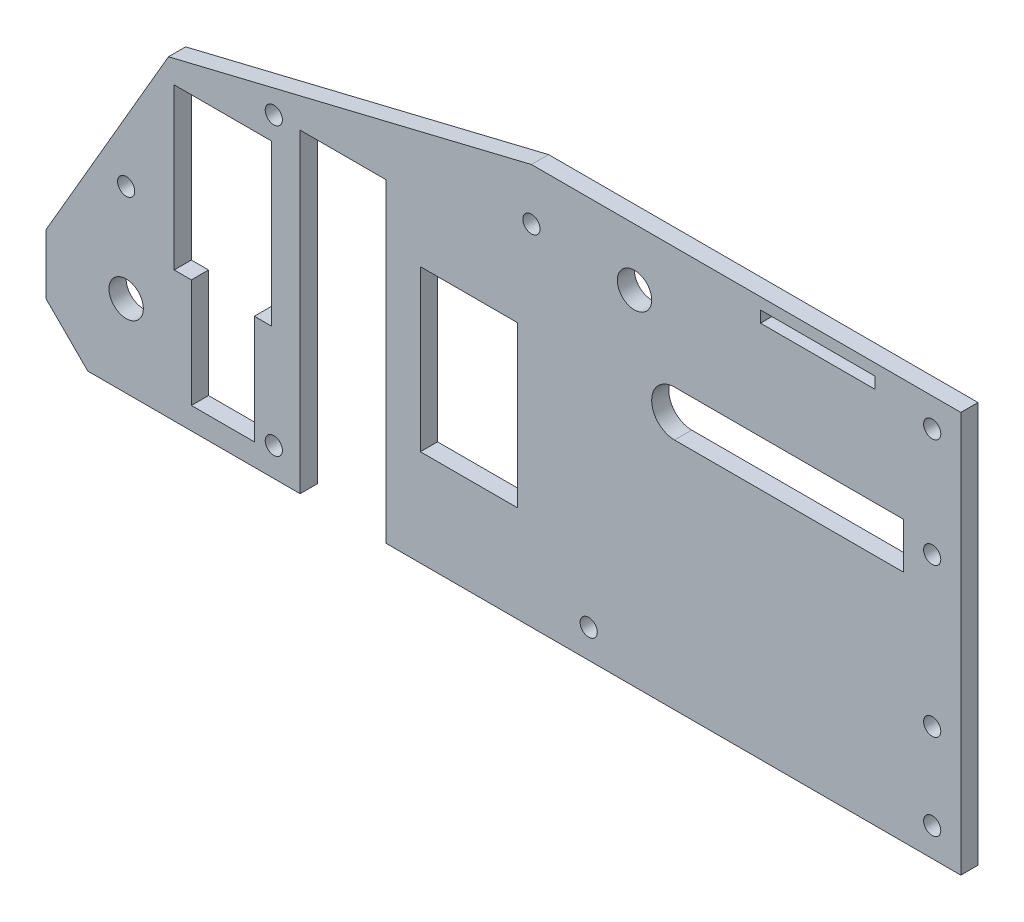
from build123d import *

# Parameters (mm, degrees)
SKETCH1_R           = 1.25
SKETCH1_R_2         = 0.75
SKETCH1_W           = 60
SKETCH1_H           = 20
SKETCH1_W_2         = 5
SKETCH1_H_2         = 1
BOSS_EXTRUDE2_DEPTH = 3
SKETCH3_R           = 1.25
CUT_EXTRUDE2_DEPTH  = 3
BOSS_EXTRUDE4_START = -3
SKETCH15_R          = 0.75
BOSS_EXTRUDE4_DEPTH = 3
SKETCH23_R          = 0.75
CUT_EXTRUDE21_DEPTH = 10
SKETCH24_R          = 0.75
CUT_EXTRUDE22_DEPTH = 10
CUT_EXTRUDE23_DEPTH = 10
SKETCH28_W          = 17
SKETCH28_H          = 28
CUT_EXTRUDE25_DEPTH = 3
SKETCH30_R          = 3
CUT_EXTRUDE26_DEPTH = 3
CUT_EXTRUDE28_DEPTH = 3
SKETCH32_R          = 3
CUT_EXTRUDE29_DEPTH = 3
SKETCH33_W          = 10
SKETCH33_H          = 1
CUT_EXTRUDE30_DEPTH = 3
CUT_EXTRUDE32_DEPTH = 3
SKETCH36_R          = 1.5
CUT_EXTRUDE33_DEPTH = 3
SKETCH37_R          = 1.5
CUT_EXTRUDE34_DEPTH = 3
CUT_EXTRUDE36_DEPTH = 3
BOSS_EXTRUDE5_START = -3
SKETCH40_R          = 1.25
BOSS_EXTRUDE5_DEPTH = 3
BOSS_EXTRUDE6_START = -3
SKETCH41_R          = 1.25
BOSS_EXTRUDE6_DEPTH = 3
SKETCH42_R          = 1.5
CUT_EXTRUDE37_DEPTH = 3
SKETCH43_R          = 1.5
CUT_EXTRUDE38_DEPTH = 3
SKETCH44_R          = 1.5
CUT_EXTRUDE39_DEPTH = 3
SKETCH45_R          = 1.5
CUT_EXTRUDE40_DEPTH = 3
SKETCH46_R          = 1.5
CUT_EXTRUDE41_DEPTH = 3
SKETCH47_W          = 20
SKETCH47_H          = 1
CUT_EXTRUDE42_DEPTH = 3
SKETCH48_W          = 11
SKETCH48_H          = 19
CUT_EXTRUDE44_DEPTH = 10


with BuildPart() as part:
    # Sketch1 → Boss-Extrude2 (new body)
    with BuildSketch(Plane.XY):
        Polygon((58.345821786, 13.119852123), (58.345821786, -56.880147877), (-191.654178214, -56.880147877), (-191.654178214, -26.880147877), (-221.654178214, -6.880147877), (-221.654178214, 33.119852123), (-121.654178214, 33.119852123), (-91.654178214, 13.119852123), align=None)
        with Locations((53.345821786, 7.945541925)):
            Circle(SKETCH1_R, mode=Mode.SUBTRACT)
        with Locations((53.345821786, -52.054458075)):
            Circle(SKETCH1_R, mode=Mode.SUBTRACT)
        with Locations((25.505821786, -18.330147877)):
            Circle(SKETCH1_R_2, mode=Mode.SUBTRACT)
        with Locations((-181.654178214, 13.119852123)):
            Rectangle(SKETCH1_W, SKETCH1_H, mode=Mode.SUBTRACT)
        with Locations((25.845821786, 10.619852123)):
            Rectangle(SKETCH1_W_2, SKETCH1_H_2, mode=Mode.SUBTRACT)
        with Locations((40.845821786, 10.619852123)):
            Rectangle(SKETCH1_W_2, SKETCH1_H_2, mode=Mode.SUBTRACT)
    extrude(amount=BOSS_EXTRUDE2_DEPTH)

    # Sketch3 → Cut-Extrude2 (cut)
    with BuildSketch(Plane.XY.offset(3)):
        with Locations((1.345821786, 3.119852123)):
            Circle(SKETCH3_R)
    extrude(amount=-CUT_EXTRUDE2_DEPTH, mode=Mode.SUBTRACT)

    # Sketch15 → Boss-Extrude4 (add)
    with BuildSketch(Plane.XY.offset(3).offset(BOSS_EXTRUDE4_START)):
        with Locations((25.505821786, -18.330147877)):
            Circle(SKETCH15_R)
    extrude(amount=BOSS_EXTRUDE4_DEPTH)

    # Sketch23 → Cut-Extrude21 (cut)
    with BuildSketch(Plane.XY.offset(3)):
        with Locations((-93.524701832, -7.521447448)):
            Circle(SKETCH23_R)
    extrude(amount=-CUT_EXTRUDE21_DEPTH, mode=Mode.SUBTRACT)

    # Sketch24 → Cut-Extrude22 (cut)
    with BuildSketch(Plane.XY.offset(3)):
        with Locations((-107.363654596, -9.638848305)):
            Circle(SKETCH24_R)
    extrude(amount=-CUT_EXTRUDE22_DEPTH, mode=Mode.SUBTRACT)

    # Sketch26 → Cut-Extrude23 (cut)
    with BuildSketch(Plane.XY.offset(3)):
        Polygon((-103.444178214, -47.580147877), (-103.444178214, -42.580147877), (-80.054178214, -2.280147877), (-16.654178214, 13.119852123), (-91.654178214, 13.119852123), (-121.654178214, 33.119852123), (-221.654178214, 33.119852123), (-221.654178214, -6.880147877), (-191.654178214, -26.880147877), (-191.654178214, -56.880147877), (-94.144178214, -56.880147877), align=None)
    extrude(amount=-CUT_EXTRUDE23_DEPTH, mode=Mode.SUBTRACT)

    # Sketch28 → Cut-Extrude25 (cut)
    with BuildSketch(Plane.XY.offset(3)):
        with Locations((-27.554178214, -26.030147877)):
            Rectangle(SKETCH28_W, SKETCH28_H)
        with Locations((-70.554178214, -20.030147877)):
            Rectangle(SKETCH28_W, SKETCH28_H)
    extrude(amount=-CUT_EXTRUDE25_DEPTH, mode=Mode.SUBTRACT)

    # Sketch30 → Cut-Extrude26 (cut)
    with BuildSketch(Plane.XY.offset(3)):
        with Locations((-87.444178214, -42.580147877)):
            Circle(SKETCH30_R)
    extrude(amount=-CUT_EXTRUDE26_DEPTH, mode=Mode.SUBTRACT)

    # Sketch31 → Cut-Extrude28 (cut)
    with BuildSketch(Plane.XY.offset(3)):
        with BuildLine():
            Line((48.345821786, -11.054458075), (48.345821786, -8.054458075))
            Line((48.345821786, -8.054458075), (8.345821786, -8.054458075))
            ThreePointArc((8.345821786, -8.054458075), (4.345821786, -12.054458075), (8.345821786, -16.054458075))
            Line((8.345821786, -16.054458075), (48.345821786, -16.054458075))
            Line((48.345821786, -16.054458075), (48.345821786, -11.054458075))
        make_face()
    extrude(amount=-CUT_EXTRUDE28_DEPTH, mode=Mode.SUBTRACT)

    # Sketch32 → Cut-Extrude29 (cut)
    with BuildSketch(Plane.XY.offset(3)):
        with Locations((1.345821786, 3.119852123)):
            Circle(SKETCH32_R)
    extrude(amount=-CUT_EXTRUDE29_DEPTH, mode=Mode.SUBTRACT)

    # Sketch33 → Cut-Extrude30 (cut)
    with BuildSketch(Plane.XY.offset(3)):
        with Locations((33.345821786, 10.619852123)):
            Rectangle(SKETCH33_W, SKETCH33_H)
    extrude(amount=-CUT_EXTRUDE30_DEPTH, mode=Mode.SUBTRACT)

    # Sketch35 → Cut-Extrude32 (cut)
    with BuildSketch(Plane.XY.offset(3)):
        Polygon((-101.444178214, -45.080147877), (-101.444178214, -39.134230818), (-103.444178214, -42.580147877), (-103.444178214, -47.580147877), (-101.444178214, -49.580147877), align=None)
    extrude(amount=-CUT_EXTRUDE32_DEPTH, mode=Mode.SUBTRACT)

    # Sketch36 → Cut-Extrude33 (cut)
    with BuildSketch(Plane.XY.offset(3)):
        with Locations((-61.654178214, -1.880147877)):
            Circle(SKETCH36_R)
    extrude(amount=-CUT_EXTRUDE33_DEPTH, mode=Mode.SUBTRACT)

    # Sketch37 → Cut-Extrude34 (cut)
    with BuildSketch(Plane.XY.offset(3)):
        with Locations((-87.444178214, -25.580147877)):
            Circle(SKETCH37_R)
    extrude(amount=-CUT_EXTRUDE34_DEPTH, mode=Mode.SUBTRACT)

    # Sketch39 → Cut-Extrude36 (cut)
    with BuildSketch(Plane.XY.offset(3)):
        Polygon((-57.054178214, -20.030147877), (-57.054178214, -56.880147877), (-42.054178214, -56.880147877), (-42.054178214, -1.880147877), (-57.054178214, -1.880147877), align=None)
    extrude(amount=-CUT_EXTRUDE36_DEPTH, mode=Mode.SUBTRACT)

    # Sketch40 → Boss-Extrude5 (add)
    with BuildSketch(Plane.XY.offset(3).offset(BOSS_EXTRUDE5_START)):
        with Locations((53.345821786, 7.945541925)):
            Circle(SKETCH40_R)
    extrude(amount=BOSS_EXTRUDE5_DEPTH)

    # Sketch41 → Boss-Extrude6 (add)
    with BuildSketch(Plane.XY.offset(3).offset(BOSS_EXTRUDE6_START)):
        with Locations((53.345821786, -52.054458075)):
            Circle(SKETCH41_R)
    extrude(amount=BOSS_EXTRUDE6_DEPTH)

    # Sketch42 → Cut-Extrude37 (cut)
    with BuildSketch(Plane.XY.offset(3)):
        with Locations((53.345821786, -51.880147877)):
            Circle(SKETCH42_R)
    extrude(amount=-CUT_EXTRUDE37_DEPTH, mode=Mode.SUBTRACT)

    # Sketch43 → Cut-Extrude38 (cut)
    with BuildSketch(Plane.XY.offset(3)):
        with Locations((-6.654178214, -51.880147877)):
            Circle(SKETCH43_R)
    extrude(amount=-CUT_EXTRUDE38_DEPTH, mode=Mode.SUBTRACT)

    # Sketch44 → Cut-Extrude39 (cut)
    with BuildSketch(Plane.XY.offset(3)):
        with Locations((-61.654178214, -51.880147877)):
            Circle(SKETCH44_R)
    extrude(amount=-CUT_EXTRUDE39_DEPTH, mode=Mode.SUBTRACT)

    # Sketch45 → Cut-Extrude40 (cut)
    with BuildSketch(Plane.XY.offset(3)):
        with Locations((53.345821786, 8.119852123)):
            Circle(SKETCH45_R)
        with Locations((53.345821786, -10.880147877)):
            Circle(SKETCH45_R)
        with Locations((53.345821786, -36.880147877)):
            Circle(SKETCH45_R)
    extrude(amount=-CUT_EXTRUDE40_DEPTH, mode=Mode.SUBTRACT)

    # Sketch46 → Cut-Extrude41 (cut)
    with BuildSketch(Plane.XY.offset(3)):
        with Locations((-16.654178214, 4.119852123)):
            Circle(SKETCH46_R)
    extrude(amount=-CUT_EXTRUDE41_DEPTH, mode=Mode.SUBTRACT)

    # Sketch47 → Cut-Extrude42 (cut)
    with BuildSketch(Plane.XY.offset(3)):
        with Locations((33.345821786, 9.619852123)):
            Rectangle(SKETCH47_W, SKETCH47_H)
    extrude(amount=-CUT_EXTRUDE42_DEPTH, mode=Mode.SUBTRACT)

    # Sketch48 → Cut-Extrude44 (cut)
    with BuildSketch(Plane.XY.offset(3)):
        with Locations((-70.554178214, -43.530147877)):
            Rectangle(SKETCH48_W, SKETCH48_H)
    extrude(amount=-CUT_EXTRUDE44_DEPTH, mode=Mode.SUBTRACT)


solid = part.part
